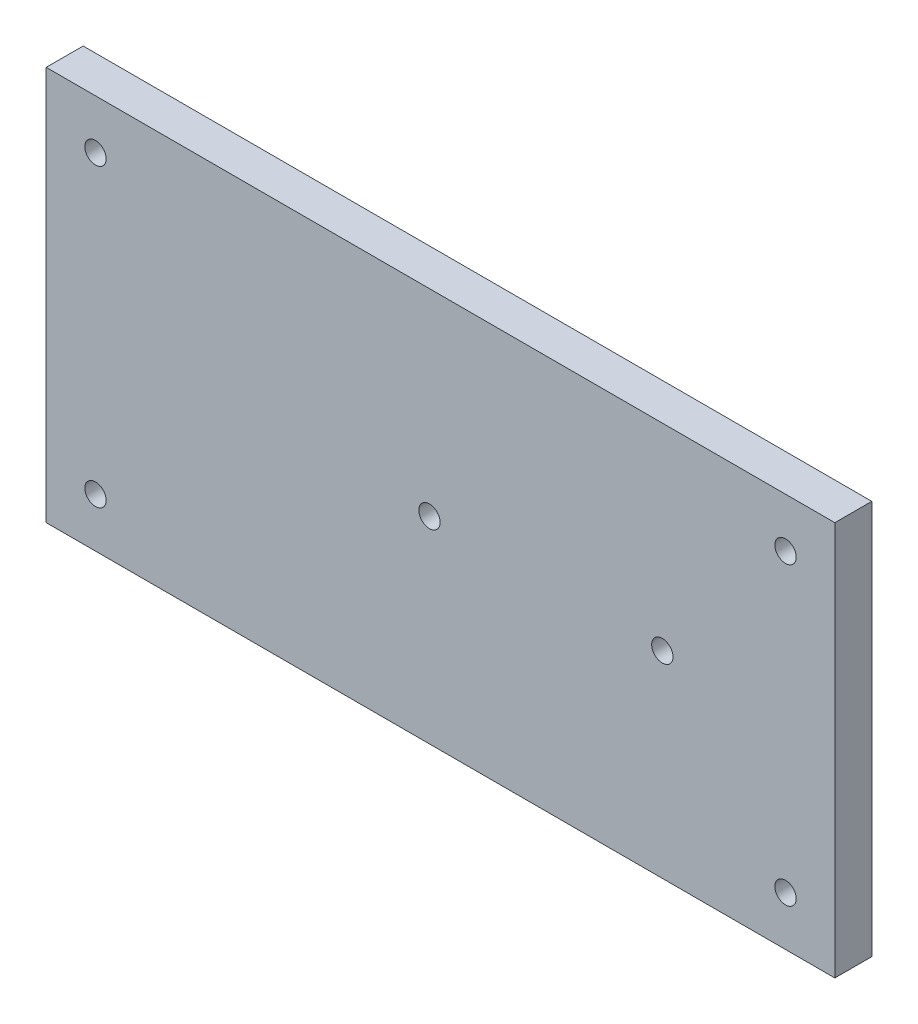
from build123d import *

# Parameters (mm, degrees)
SKETCH1_W                       = 203.2
SKETCH1_H                       = 101.6
BOSS_EXTRUDE1_DEPTH             = 9.525
CUT_EXTRUDE1_DEPTH              = 93.98
CUT_EXTRUDE1_DEPTH_BACK         = 228.384092726
SKETCH2_W                       = 1.5875
SKETCH2_H                       = 50.8
CBORE_FOR_M5_SBHCS1_D           = 5.5
CBORE_FOR_M5_SBHCS1_CBORE_D     = 10.5
CBORE_FOR_M5_SBHCS1_CBORE_DEPTH = 2.75
M5_CLEARANCE_HOLE1_D            = 5.5


with BuildPart() as part:
    # Sketch1 → Boss-Extrude1 (new body)
    with BuildSketch(Plane.XY):
        with Locations((101.6, 50.8)):
            Rectangle(SKETCH1_W, SKETCH1_H)
    extrude(amount=BOSS_EXTRUDE1_DEPTH)

    # Sketch2 → Cut-Extrude1 (cut, two sides: drawn at the far end of the back side and taken through both)
    with BuildSketch(Plane(origin=(0, 0, 0), x_dir=(0, 0, -1), z_dir=(1, 0, 0)).offset(-CUT_EXTRUDE1_DEPTH_BACK)):
        with Locations((-0.79375, 50.8)):
            Rectangle(SKETCH2_W, SKETCH2_H)
    extrude(amount=CUT_EXTRUDE1_DEPTH + CUT_EXTRUDE1_DEPTH_BACK, mode=Mode.SUBTRACT)

    # CBORE for M5 SBHCS1 (through all)
    with Locations(Plane(origin=(0, 0, 0), x_dir=(-1, 0, 0), z_dir=(0, 0, -1))):
        with Locations((-190.5, 88.9), (-12.7, 88.9), (-12.7, 12.7), (-190.5, 12.7)):
            CounterBoreHole(CBORE_FOR_M5_SBHCS1_D / 2, CBORE_FOR_M5_SBHCS1_CBORE_D / 2, CBORE_FOR_M5_SBHCS1_CBORE_DEPTH)

    # M5 Clearance Hole1 (through all)
    with Locations(Plane.XY.offset(9.525)):
        with Locations((158.75, 50.8), (98.7552, 50.8)):
            Hole(M5_CLEARANCE_HOLE1_D / 2)


solid = part.part
